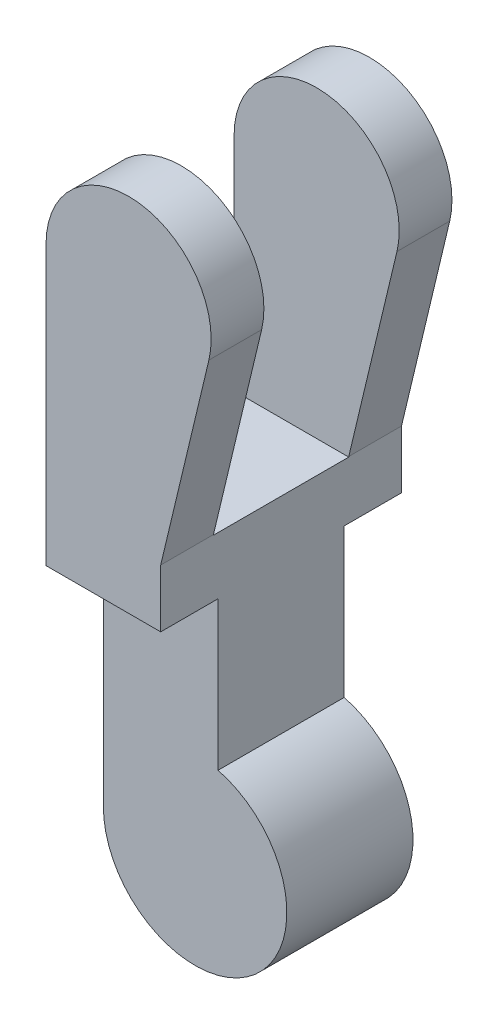
from build123d import *

# Parameters (mm, degrees)
BOSS_EXTRUDE1_DEPTH     = 105
CUT_EXTRUDE1_DEPTH      = 539.431982705
CUT_EXTRUDE1_DEPTH_BACK = 539.431982705
SKETCH2_W               = 118
SKETCH2_H               = 265
SKETCH2_W_2             = 50
SKETCH2_H_2             = 287


with BuildPart() as part:
    # Sketch1 → Boss-Extrude1 (new, symmetric)
    with BuildSketch(Plane.XY):
        with BuildLine():
            Line((-80, 0), (-80, 450))
            ThreePointArc((-80, 450), (0.428269124, 521.504994788), (62.026785544, 433.259351673))
            Line((62.026785544, 433.259351673), (20, 257.459666924))
            Line((20, 257.459666924), (20, 77.459666924))
            ThreePointArc((20, 77.459666924), (48.989794856, -63.245553203), (-80, 0))
        make_face()
    extrude(amount=BOSS_EXTRUDE1_DEPTH, both=True)

    # Sketch2 → Cut-Extrude1 (cut, two sides: drawn at the far end of the back side and taken through both)
    with BuildSketch(Plane(origin=(0, 0, 0), x_dir=(0, 0, -1), z_dir=(1, 0, 0)).offset(-CUT_EXTRUDE1_DEPTH_BACK)):
        with Locations((0, 389.5)):
            Rectangle(SKETCH2_W, SKETCH2_H)
        with Locations((-80, 63.5)):
            Rectangle(SKETCH2_W_2, SKETCH2_H_2)
        with Locations((80, 63.5)):
            Rectangle(SKETCH2_W_2, SKETCH2_H_2)
    extrude(amount=CUT_EXTRUDE1_DEPTH + CUT_EXTRUDE1_DEPTH_BACK, mode=Mode.SUBTRACT)


solid = part.part
